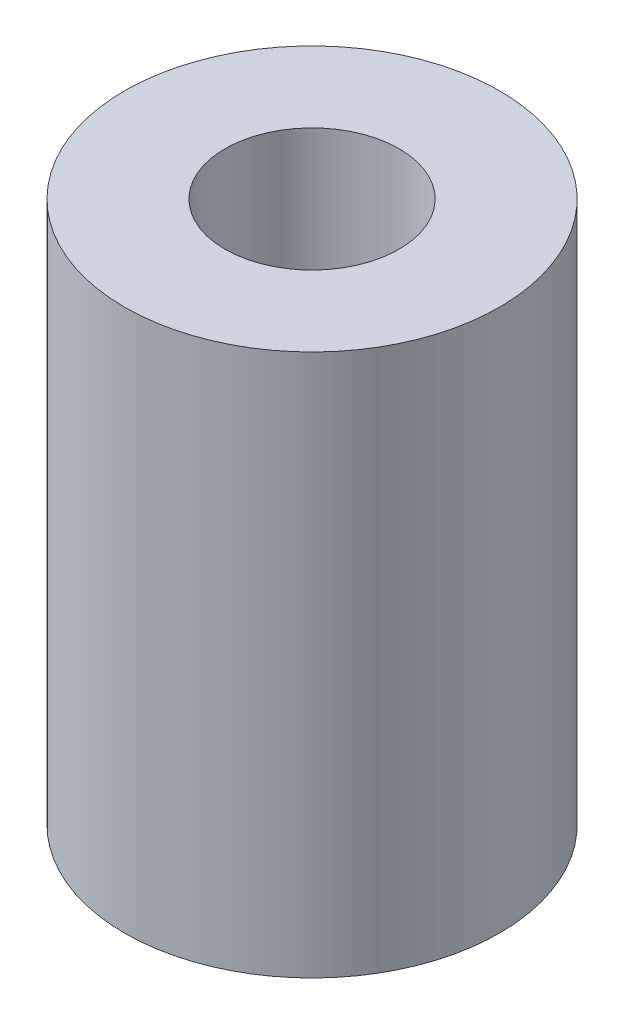
from build123d import *

# Parameters (mm, degrees)
SKETCH1_R           = 4.1275
SKETCH1_R_2         = 1.9177
BOSS_EXTRUDE1_DEPTH = 11.938


with BuildPart() as part:
    # Sketch1 → Boss-Extrude1 (new body)
    with BuildSketch(Plane(origin=(0, 0, 0), x_dir=(1, 0, 0), z_dir=(0, 1, 0))):
        with Locations(Location((0, 0, 0), (0, 0, 270))):
            Circle(SKETCH1_R)
        with Locations(Location((0, 0, 0), (0, 0, 270))):
            Circle(SKETCH1_R_2, mode=Mode.SUBTRACT)
    extrude(amount=BOSS_EXTRUDE1_DEPTH)


solid = part.part
